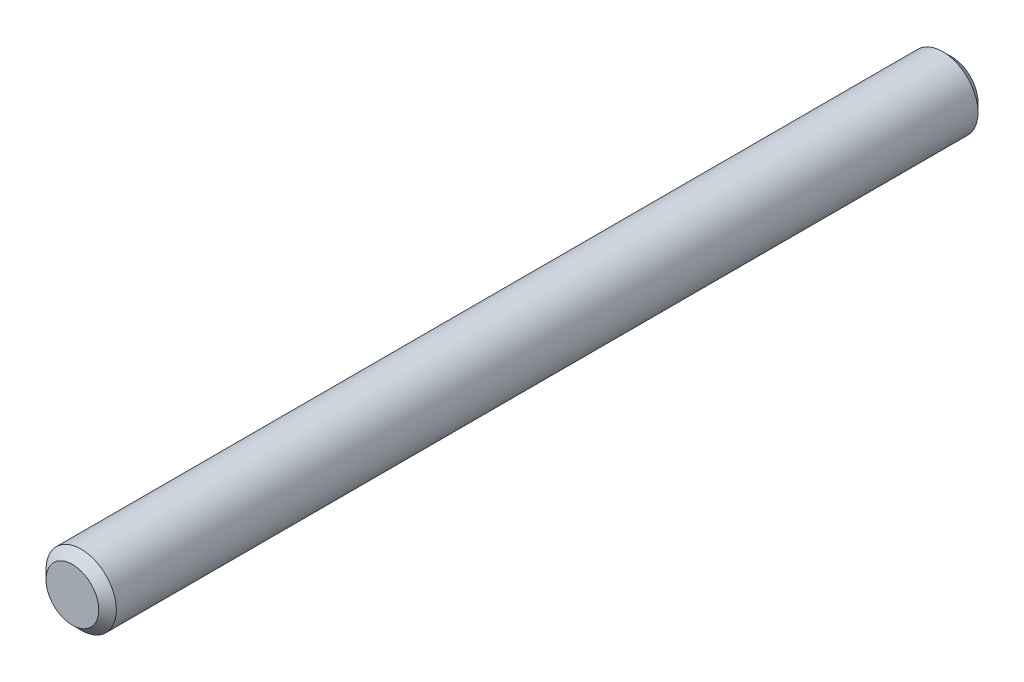
from build123d import *

# Parameters (mm, degrees)
SKETCH1_R           = 4
BOSS_EXTRUDE1_DEPTH = 100
CHAMFER1_SIZE       = 1


with BuildPart() as part:
    # Sketch1 → Boss-Extrude1 (new body)
    with BuildSketch(Plane.XY):
        Circle(SKETCH1_R)
    extrude(amount=BOSS_EXTRUDE1_DEPTH)

    # Chamfer1
    chamfer1_edges = [part.edges().sort_by_distance(p)[0] for p in [
        (-4, 0, 0),
        (-4, 0, 100),
    ]]
    chamfer(chamfer1_edges, length=CHAMFER1_SIZE)


solid = part.part
